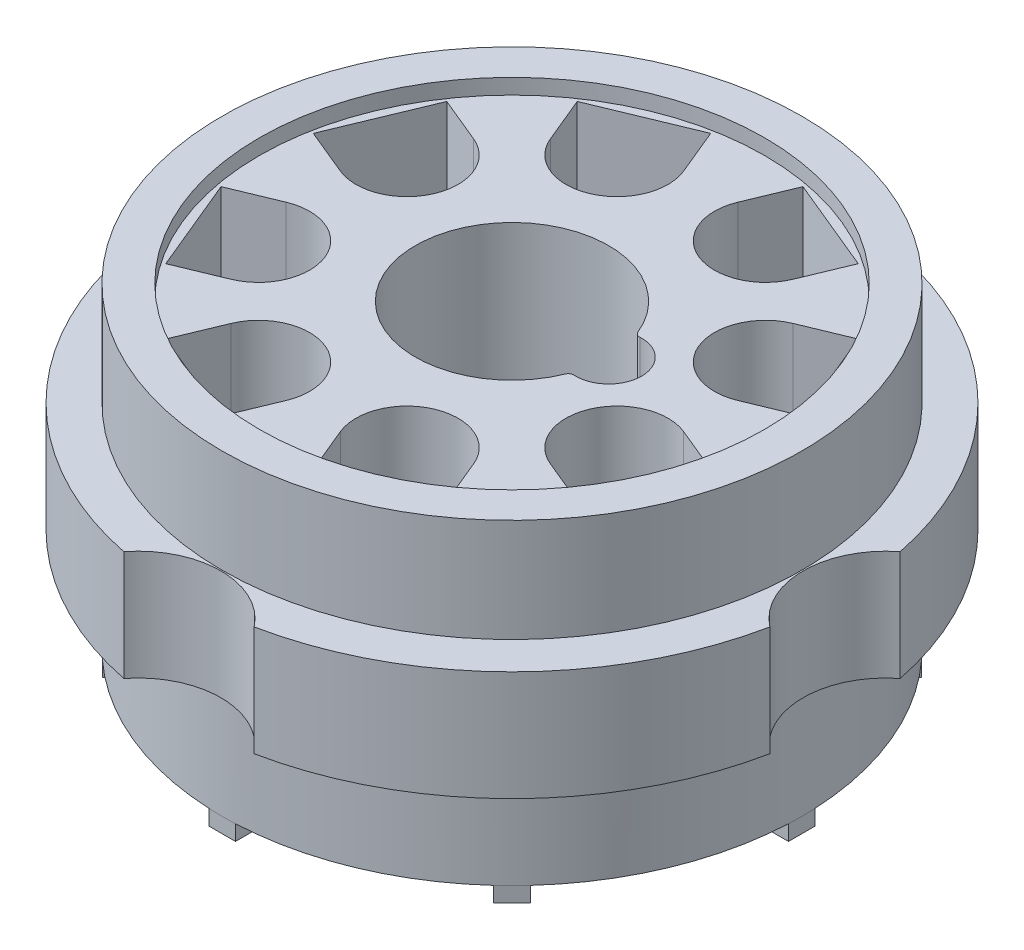
from build123d import *

# Parameters (mm, degrees)
SKETCH2_R           = 11.5
EXTRUDE1_DEPTH      = 0.7
SKETCH4_R           = 6.5
EXTRUDE3_DEPTH      = 1
SKETCH5_W           = 6.714108136
SKETCH5_H           = 1.2
EXTRUDE4_DEPTH      = 0.7
EXTRUDE2_DEPTH      = 24.758998295
EXTRUDE2_DEPTH_BACK = 24.758998295
CIRPATTERN1_COUNT   = 8
EXTRUDE5_DEPTH      = 12.3
EXTRUDE6_DEPTH      = 26.639032743
CIRPATTERN2_COUNT   = 8
SKETCH10_R          = 3.75
EXTRUDE7_DEPTH      = 12.3
CIRPATTERN3_COUNT   = 4


with BuildPart() as part:
    # Sketch1 → Revolve1 (revolve)
    with BuildSketch(Plane.XY):
        Polygon((-13.2, 0), (-13.2, 4.7), (0, 4.7), (0, -9.7), (-13.2, -9.7), (-13.2, -5), (-15, -5), (-15, 0), align=None)
    revolve(axis=Axis((0, 20.644864938, 0), (0, -1, 0)))

    # Sketch2 → Extrude1 (cut)
    with BuildSketch(Plane(origin=(0, 4.7, 0), x_dir=(1, 0, 0), z_dir=(0, 1, 0))):
        Circle(SKETCH2_R)
    extrude(amount=-EXTRUDE1_DEPTH, mode=Mode.SUBTRACT)

    # Sketch4 → Extrude3 (add)
    with BuildSketch(Plane.XZ.offset(9.7)):
        Circle(SKETCH4_R)
    extrude(amount=EXTRUDE3_DEPTH)

    # Sketch5 → Extrude4 (add)
    with BuildSketch(Plane.XZ.offset(9.7)):
        with Locations((9.829302518, 0)):
            Rectangle(SKETCH5_W, SKETCH5_H)
    extrude4 = extrude(amount=EXTRUDE4_DEPTH)

    # Sketch3 → Extrude2 (cut, two sides: drawn at the far end of the back side and taken through both)
    with BuildSketch(Plane(origin=(0, 0, 0), x_dir=(1, 0, 0), z_dir=(0, 1, 0)).offset(-EXTRUDE2_DEPTH_BACK)):
        with BuildLine():
            ThreePointArc((4.077419355, 1.653678144), (-4.4, 0), (4.077419355, -1.653678144))
            ThreePointArc((4.077419355, -1.653678144), (4.17486489, -1.536726305), (4.322077922, -1.497974683))
            ThreePointArc((4.322077922, -1.497974683), (5.9, 0), (4.322077922, 1.497974683))
            ThreePointArc((4.322077922, 1.497974683), (4.17486489, 1.536726305), (4.077419355, 1.653678144))
        make_face()
    extrude(amount=EXTRUDE2_DEPTH + EXTRUDE2_DEPTH_BACK, mode=Mode.SUBTRACT)

    # CirPattern1: Extrude4 ×8 about axis
    cirpattern1_axis = Axis((0, 55, 0), (0, -1, 0))
    for i in range(1, CIRPATTERN1_COUNT):
        add(extrude4.rotate(cirpattern1_axis, i * 360 / CIRPATTERN1_COUNT))

    # Sketch7 → Extrude5 (cut)
    with BuildSketch(Plane(origin=(0, 4, 0), x_dir=(1, 0, 0), z_dir=(0, 1, 0))):
        with BuildLine():
            Line((9.365323831, 6.395806012), (11.144801791, 2.099766186))
            Line((11.144801791, 2.099766186), (9.04959703, 1.231903958))
            ThreePointArc((9.04959703, 1.231903958), (6.011838137, 2.490184891), (7.27011907, 5.527943784))
            Line((7.27011907, 5.527943784), (9.365323831, 6.395806012))
        make_face()
    extrude5 = extrude(amount=-EXTRUDE5_DEPTH, mode=Mode.SUBTRACT)

    # Sketch9 → Extrude6 (cut, through all)
    with BuildSketch(Plane.XZ.offset(9.7)):
        Polygon((10.561772814, -1.939447092), (8.839697369, -6.096904988), (7.915817836, -5.714221556), (9.637893282, -1.556763659), align=None)
    extrude6 = extrude(amount=-EXTRUDE6_DEPTH, mode=Mode.SUBTRACT)

    # CirPattern2: Extrude5, Extrude6 ×8 about axis
    cirpattern2_axis = Axis((0, 55, 0), (0, -1, 0))
    add([extrude5.rotate(cirpattern2_axis, i * 360 / CIRPATTERN2_COUNT) for i in range(1, CIRPATTERN2_COUNT)], mode=Mode.SUBTRACT)
    add([extrude6.rotate(cirpattern2_axis, i * 360 / CIRPATTERN2_COUNT) for i in range(1, CIRPATTERN2_COUNT)], mode=Mode.SUBTRACT)

    # Sketch10 → Extrude7 (cut)
    with BuildSketch(Plane(origin=(0, 0, 0), x_dir=(1, 0, 0), z_dir=(0, 1, 0))):
        with Locations((17, 0)):
            Circle(SKETCH10_R)
    extrude7 = extrude(amount=-EXTRUDE7_DEPTH, mode=Mode.SUBTRACT)

    # CirPattern3: Extrude7 ×4 about axis
    cirpattern3_axis = Axis((0, 55, 0), (0, -1, 0))
    for i in range(1, CIRPATTERN3_COUNT):
        add(extrude7.rotate(cirpattern3_axis, i * 360 / CIRPATTERN3_COUNT), mode=Mode.SUBTRACT)


solid = part.part
